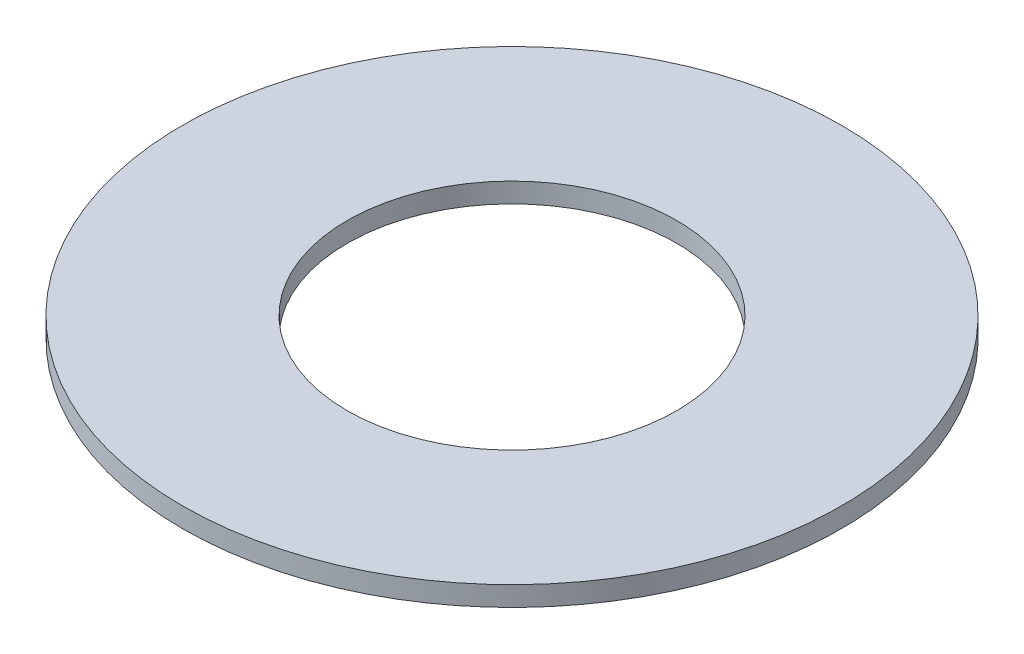
from build123d import *

# Parameters (mm, degrees)
SKETCH1_W = 3.175
SKETCH1_H = 0.381


with BuildPart() as part:
    # Sketch1 → Revolve1 (revolve)
    with BuildSketch(Plane(origin=(0, 0, 0), x_dir=(0, 0, -1), z_dir=(1, 0, 0)), mode=Mode.PRIVATE) as revolve1_sk:
        with Locations((4.7625, 0)):
            Rectangle(SKETCH1_W, SKETCH1_H)
    revolve(revolve1_sk.sketch.rotate(Axis((0, 14.286213682, 0), (0, -1, 0)), 180), axis=Axis((0, 14.286213682, 0), (0, -1, 0)))


solid = part.part
